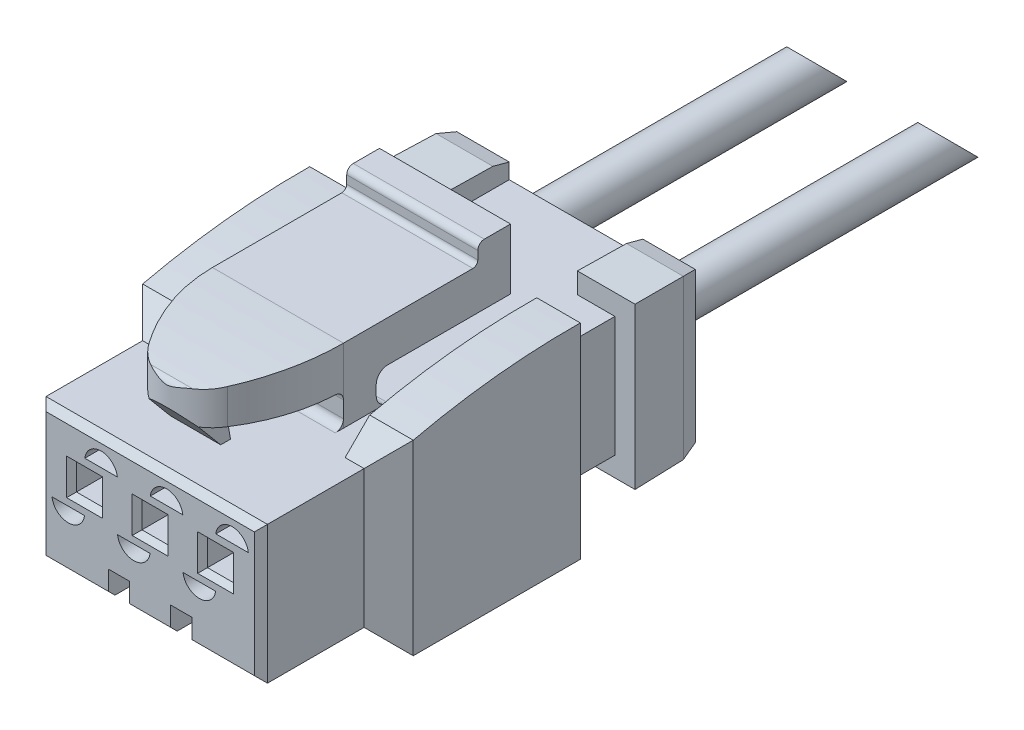
from build123d import *

# Parameters (mm, degrees)
BOSS_EXTRUDE1_DEPTH      = 4.15
BOSS_EXTRUDE1_DEPTH_BACK = 4.15
CUT_EXTRUDE1_DEPTH       = 6
CUT_EXTRUDE1_DEPTH_BACK  = 6
SKETCH2_W                = 10
SKETCH2_H                = 15
CUT_EXTRUDE2_DEPTH       = 2
BOSS_EXTRUDE2_DEPTH      = 2
BOSS_EXTRUDE2_DEPTH_BACK = 2
SKETCH5_W                = 4.4
SKETCH5_H                = 9
CUT_EXTRUDE3_DEPTH       = 3
CUT_EXTRUDE4_DEPTH       = 1
BOSS_EXTRUDE3_DEPTH      = 1
CUT_EXTRUDE5_DEPTH       = 3.2
SKETCH9_W                = 0.8
SKETCH9_H                = 0.8
CUT_EXTRUDE6_DEPTH       = 2.9
SKETCH10_W               = 0.8
SKETCH10_H               = 0.8
CUT_EXTRUDE7_DEPTH       = 2.9
SKETCH11_W               = 0.8
SKETCH11_H               = 0.8
CUT_EXTRUDE8_DEPTH       = 2.9
CUT_EXTRUDE9_DEPTH       = 2.9
CUT_EXTRUDE10_DEPTH      = 2.9
CUT_EXTRUDE11_DEPTH      = 2.9
CUT_EXTRUDE12_DEPTH      = 2.9
CUT_EXTRUDE13_DEPTH      = 2.9
CUT_EXTRUDE14_DEPTH      = 2.9
CUT_EXTRUDE15_DEPTH      = 1.1
BOSS_EXTRUDE4_DEPTH      = 3
BOSS_EXTRUDE4_DEPTH_BACK = 3
SKETCH20_R               = 0.65
BOSS_EXTRUDE5_DEPTH      = 10
SKETCH21_R               = 0.65
BOSS_EXTRUDE6_DEPTH      = 10
CUT_EXTRUDE16_DEPTH      = 3
CUT_EXTRUDE16_DEPTH_BACK = 3


with BuildPart() as part:
    # Sketch1 → Boss-Extrude1 (new, two sides: drawn at the far end of the back side and taken through both)
    with BuildSketch(Plane(origin=(0, 0, 0), x_dir=(0, 0, -1), z_dir=(1, 0, 0)).offset(-BOSS_EXTRUDE1_DEPTH_BACK)):
        with BuildLine():
            Line((-13, 1.4), (-13, -2.4))
            Line((-13, -2.4), (-12.8, -2.6))
            Line((-12.8, -2.6), (-9.85, -2.6))
            Line((-9.85, -2.6), (-9.1, -3.35))
            Line((-9.1, -3.35), (-4, -3.35))
            Line((-4, -3.35), (-4, -2.07))
            Line((-4, -2.07), (-2, -2.07))
            Line((-2, -2.07), (-2, -2.67))
            Line((-2, -2.67), (-0.5, -2.643817403))
            Line((-0.5, -2.643817403), (0, -2.509842806))
            Line((0, -2.509842806), (0, 2.069842806))
            Line((0, 2.069842806), (-0.5, 2.203817403))
            Line((-0.5, 2.203817403), (-2, 2.23))
            Line((-2, 2.23), (-2, 1.6))
            Line((-2, 1.6), (-4, 1.6))
            Line((-4, 1.6), (-4, 2.9))
            ThreePointArc((-4, 2.9), (-6.566392361, 2.777001893), (-9.1, 2.35))
            Line((-9.1, 2.35), (-9.85, 1.6))
            Line((-9.85, 1.6), (-12.8, 1.6))
            Line((-12.8, 1.6), (-13, 1.4))
        make_face()
    extrude(amount=BOSS_EXTRUDE1_DEPTH + BOSS_EXTRUDE1_DEPTH_BACK)

    # Sketch2 → Cut-Extrude1 (cut, two sides: drawn at the far end of the back side and taken through both)
    with BuildSketch(Plane(origin=(0, 0, 0), x_dir=(1, 0, 0), z_dir=(0, 1, 0)).offset(-CUT_EXTRUDE1_DEPTH_BACK)):
        with Locations((0, -6.5)):
            Rectangle(SKETCH2_W, SKETCH2_H)
        Polygon((-4.13, -9.1), (-3.38, -9.85), (-3.38, -12.8), (-3.18, -13), (3.18, -13), (3.38, -12.8), (3.38, -9.85), (4.13, -9.1), (4.13, -4), (3.185, -4), (3.185, -2), (3.8, -2), (3.773817403, -0.5), (3.639842806, 0), (-3.639842806, 0), (-3.773817403, -0.5), (-3.8, -2), (-3.185, -2), (-3.185, -4), (-4.13, -4), align=None, mode=Mode.SUBTRACT)
    extrude(amount=CUT_EXTRUDE1_DEPTH + CUT_EXTRUDE1_DEPTH_BACK, mode=Mode.SUBTRACT)

    # Sketch3 → Cut-Extrude2 (cut)
    with BuildSketch(Plane(origin=(0, 1.6, 0), x_dir=(1, 0, 0), z_dir=(0, 1, 0))):
        Polygon((-2.8, -4), (-2.8, -13), (2.8, -13), (2.8, -4), (2.04, -4), (2.04, 0), (-2.04, 0), (-2.04, -4), align=None)
    extrude(amount=CUT_EXTRUDE2_DEPTH, mode=Mode.SUBTRACT)

    # Sketch4 → Boss-Extrude2 (add, two sides: drawn at the far end of the back side and taken through both)
    with BuildSketch(Plane(origin=(0, 0, 0), x_dir=(0, 0, -1), z_dir=(1, 0, 0)).offset(-BOSS_EXTRUDE2_DEPTH_BACK)):
        with BuildLine():
            Line((-12.51, 3.388062852), (-12.51, 2.87))
            Line((-12.51, 2.87), (-11.612163395, 1.8))
            Line((-11.612163395, 1.8), (-11.312163395, 1.8))
            Line((-11.312163395, 1.8), (-11.411835811, 2.365270364))
            ThreePointArc((-11.411835811, 2.365270364), (-11.368083149, 2.528557522), (-11.214874261, 2.6))
            Line((-11.214874261, 2.6), (-9.35, 2.6))
            ThreePointArc((-9.35, 2.6), (-9.173223305, 2.526776695), (-9.1, 2.35))
            Line((-9.1, 2.35), (-9.1, 1.85))
            ThreePointArc((-9.1, 1.85), (-9.173223305, 1.673223305), (-9.35, 1.6))
            Line((-9.35, 1.6), (-9.35, 0.6))
            Line((-9.35, 0.6), (-7.75, 0.6))
            Line((-7.75, 0.6), (-7.75, 1.6))
            ThreePointArc((-7.75, 1.6), (-7.997487373, 1.702512627), (-8.1, 1.95))
            Line((-8.1, 1.95), (-8.1, 2.25))
            ThreePointArc((-8.1, 2.25), (-7.997487373, 2.497487373), (-7.75, 2.6))
            Line((-7.75, 2.6), (-4, 2.6))
            Line((-4, 2.6), (-4, 4.45))
            Line((-4, 4.45), (-4.8, 4.45))
            ThreePointArc((-4.8, 4.45), (-4.941421356, 4.391421356), (-5, 4.25))
            Line((-5, 4.25), (-5, 4))
            ThreePointArc((-5, 4), (-5.043933983, 3.893933983), (-5.15, 3.85))
            Line((-5.15, 3.85), (-9.1, 3.85))
            ThreePointArc((-9.1, 3.85), (-10.726600682, 3.783744511), (-12.342424242, 3.585417022))
            ThreePointArc((-12.342424242, 3.585417022), (-12.462454663, 3.517513907), (-12.51, 3.388062852))
        make_face()
    extrude(amount=BOSS_EXTRUDE2_DEPTH + BOSS_EXTRUDE2_DEPTH_BACK)

    # Sketch5 → Cut-Extrude3 (cut)
    with BuildSketch(Plane(origin=(0, 1.6, 0), x_dir=(1, 0, 0), z_dir=(0, 1, 0))):
        with Locations((0, -8.3)):
            Rectangle(SKETCH5_W, SKETCH5_H)
        with BuildLine():
            Line((2, -9.1), (2, -4))
            Line((2, -4), (-2, -4))
            Line((-2, -4), (-2, -9.1))
            ThreePointArc((-2, -9.1), (-1.793181663, -10.523168838), (-1.189836183, -11.828602712))
            ThreePointArc((-1.189836183, -11.828602712), (0, -12.5), (1.189836183, -11.828602712))
            ThreePointArc((1.189836183, -11.828602712), (1.793181663, -10.523168838), (2, -9.1))
        make_face(mode=Mode.SUBTRACT)
    extrude(amount=CUT_EXTRUDE3_DEPTH, mode=Mode.SUBTRACT)

    # Sketch6 → Cut-Extrude4 (cut)
    with BuildSketch(Plane(origin=(0, 1.6, 0), x_dir=(1, 0, 0), z_dir=(0, 1, 0))):
        Polygon((-2, -10.5), (-2, -13), (-0.765, -13), (-0.765, -10.7), (0.765, -10.7), (0.765, -13), (2, -13), (2, -10.5), (0.765, -10.5), (0.765, -4), (2, -4), (2, -3), (-2, -3), (-2, -4), (-0.765, -4), (-0.765, -10.5), align=None)
    extrude(amount=CUT_EXTRUDE4_DEPTH, mode=Mode.SUBTRACT)

    # Sketch7 → Boss-Extrude3 (add)
    with BuildSketch(Plane.XY.offset(4)):
        with BuildLine():
            Line((-2.3, -3.35), (-2.190561659, -3.35))
            ThreePointArc((-2.190561659, -3.35), (-2.065337959, -3.394054417), (-1.995280829, -3.50680975))
            ThreePointArc((-1.995280829, -3.50680975), (-1.948171085, -3.597952406), (-1.862068966, -3.653744311))
            ThreePointArc((-1.862068966, -3.653744311), (0, -3.95), (1.862068966, -3.653744311))
            ThreePointArc((1.862068966, -3.653744311), (1.948171087, -3.597952405), (1.99528083, -3.506809747))
            ThreePointArc((1.99528083, -3.506809747), (2.06533796, -3.394054416), (2.190561659, -3.35))
            Line((2.190561659, -3.35), (2.3, -3.35))
            Line((2.3, -3.35), (2, 0))
            Line((2, 0), (-2, 0))
            Line((-2, 0), (-2.3, -3.35))
        make_face()
    extrude(amount=BOSS_EXTRUDE3_DEPTH)

    # Sketch8 → Cut-Extrude5 (cut)
    with BuildSketch(Plane.XY.offset(9.85)):
        Polygon((-1.275, -1.81), (-1.275, -3.41), (1.275, -3.41), (1.275, -1.81), (0.625, -1.81), (0.625, -2.61), (-0.625, -2.61), (-0.625, -1.81), align=None)
    extrude(amount=CUT_EXTRUDE5_DEPTH, mode=Mode.SUBTRACT)

    # Sketch9 → Cut-Extrude6 (cut)
    with BuildSketch(Plane.XY.offset(13)):
        with Locations((-2, -0.01)):
            Rectangle(SKETCH9_W, SKETCH9_H)
    extrude(amount=-CUT_EXTRUDE6_DEPTH, mode=Mode.SUBTRACT)

    # Sketch10 → Cut-Extrude7 (cut)
    with BuildSketch(Plane.XY.offset(13)):
        with Locations((0, -0.01)):
            Rectangle(SKETCH10_W, SKETCH10_H)
    extrude(amount=-CUT_EXTRUDE7_DEPTH, mode=Mode.SUBTRACT)

    # Sketch11 → Cut-Extrude8 (cut)
    with BuildSketch(Plane.XY.offset(13)):
        with Locations((2, -0.01)):
            Rectangle(SKETCH11_W, SKETCH11_H)
    extrude(amount=-CUT_EXTRUDE8_DEPTH, mode=Mode.SUBTRACT)

    # Sketch12 → Cut-Extrude9 (cut)
    with BuildSketch(Plane.XY.offset(13)):
        with BuildLine():
            Line((-2.003613054, -0.76), (-2.996386946, -0.76))
            ThreePointArc((-2.996386946, -0.76), (-2.5, -1.2), (-2.003613054, -0.76))
        make_face()
    extrude(amount=-CUT_EXTRUDE9_DEPTH, mode=Mode.SUBTRACT)

    # Sketch13 → Cut-Extrude10 (cut)
    with BuildSketch(Plane.XY.offset(13)):
        with BuildLine():
            Line((0.003613054, 0.76), (0.996386946, 0.76))
            ThreePointArc((0.996386946, 0.76), (0.5, 1.2), (0.003613054, 0.76))
        make_face()
    extrude(amount=-CUT_EXTRUDE10_DEPTH, mode=Mode.SUBTRACT)

    # Sketch14 → Cut-Extrude11 (cut)
    with BuildSketch(Plane.XY.offset(13)):
        with BuildLine():
            Line((2.003613054, 0.76), (2.996386946, 0.76))
            ThreePointArc((2.996386946, 0.76), (2.5, 1.2), (2.003613054, 0.76))
        make_face()
    extrude(amount=-CUT_EXTRUDE11_DEPTH, mode=Mode.SUBTRACT)

    # Sketch15 → Cut-Extrude12 (cut)
    with BuildSketch(Plane.XY.offset(13)):
        with BuildLine():
            Line((-1.996386946, 0.76), (-1.003613054, 0.76))
            ThreePointArc((-1.003613054, 0.76), (-1.5, 1.2), (-1.996386946, 0.76))
        make_face()
    extrude(amount=-CUT_EXTRUDE12_DEPTH, mode=Mode.SUBTRACT)

    # Sketch16 → Cut-Extrude13 (cut)
    with BuildSketch(Plane.XY.offset(13)):
        with BuildLine():
            Line((-0.003613054, -0.76), (-0.996386946, -0.76))
            ThreePointArc((-0.996386946, -0.76), (-0.5, -1.2), (-0.003613054, -0.76))
        make_face()
    extrude(amount=-CUT_EXTRUDE13_DEPTH, mode=Mode.SUBTRACT)

    # Sketch17 → Cut-Extrude14 (cut)
    with BuildSketch(Plane.XY.offset(13)):
        with BuildLine():
            Line((1.996386946, -0.76), (1.003613054, -0.76))
            ThreePointArc((1.003613054, -0.76), (1.5, -1.2), (1.996386946, -0.76))
        make_face()
    extrude(amount=-CUT_EXTRUDE14_DEPTH, mode=Mode.SUBTRACT)

    # Sketch18 → Cut-Extrude15 (cut)
    with BuildSketch(Plane(origin=(0, -0.56, 0), x_dir=(1, 0, 0), z_dir=(0, 1, 0))):
        Polygon((-2.55, -13), (-2.55, -13.5), (2.55, -13.5), (2.55, -13), (2.05, -12.5), (1.95, -12.5), (1.45, -13), (0.55, -13), (0.05, -12.5), (-0.05, -12.5), (-0.55, -13), (-1.45, -13), (-1.95, -12.5), (-2.05, -12.5), align=None)
    extrude(amount=CUT_EXTRUDE15_DEPTH, mode=Mode.SUBTRACT)

    # Sketch19 → Boss-Extrude4 (add, two sides: drawn at the far end of the back side and taken through both)
    with BuildSketch(Plane(origin=(0, 0, 0), x_dir=(0, 0, -1), z_dir=(1, 0, 0)).offset(-BOSS_EXTRUDE4_DEPTH_BACK)):
        Polygon((-13, 0.54), (-12.85, 0.39), (-8.1, 0.39), (-8.1, -0.41), (-12.85, -0.41), (-13, -0.56), (-8, -0.56), (-8, 0.54), align=None)
    extrude(amount=BOSS_EXTRUDE4_DEPTH + BOSS_EXTRUDE4_DEPTH_BACK)

    # Sketch20 → Boss-Extrude5 (add)
    with BuildSketch(Plane.XY):
        with Locations((2, 0)):
            Circle(SKETCH20_R)
    extrude(amount=-BOSS_EXTRUDE5_DEPTH)

    # Sketch21 → Boss-Extrude6 (add)
    with BuildSketch(Plane.XY):
        with Locations((-2, 0)):
            Circle(SKETCH21_R)
    extrude(amount=-BOSS_EXTRUDE6_DEPTH)

    # Sketch22 → Cut-Extrude16 (cut, two sides: drawn at the far end of the back side and taken through both)
    with BuildSketch(Plane(origin=(0, 0, 0), x_dir=(0, 0, -1), z_dir=(1, 0, 0)).offset(-CUT_EXTRUDE16_DEPTH_BACK)):
        Polygon((8.5, 0.85), (10, -0.65), (10, 0.85), align=None)
    extrude(amount=CUT_EXTRUDE16_DEPTH + CUT_EXTRUDE16_DEPTH_BACK, mode=Mode.SUBTRACT)


solid = part.part
